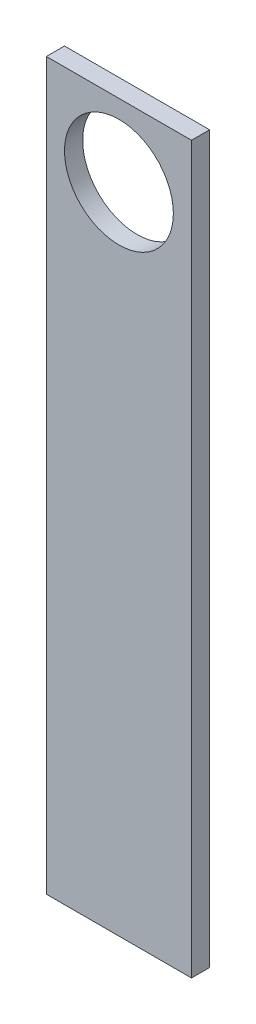
from build123d import *

# Parameters (mm, degrees)
SKETCH1_W           = 25.4
SKETCH1_H           = 127
BOSS_EXTRUDE1_DEPTH = 3.175
SKETCH2_R           = 9.525
CUT_EXTRUDE1_DEPTH  = 3.175


with BuildPart() as part:
    # Sketch1 → Boss-Extrude1 (new body)
    with BuildSketch(Plane.XY):
        with Locations((-8.555028463, -46.486337761)):
            Rectangle(SKETCH1_W, SKETCH1_H)
    extrude(amount=BOSS_EXTRUDE1_DEPTH)

    # Sketch2 → Cut-Extrude1 (cut)
    with BuildSketch(Plane.XY.offset(3.175)):
        with Locations((-8.555028463, 4.313662239)):
            Circle(SKETCH2_R)
    extrude(amount=-CUT_EXTRUDE1_DEPTH, mode=Mode.SUBTRACT)


solid = part.part
